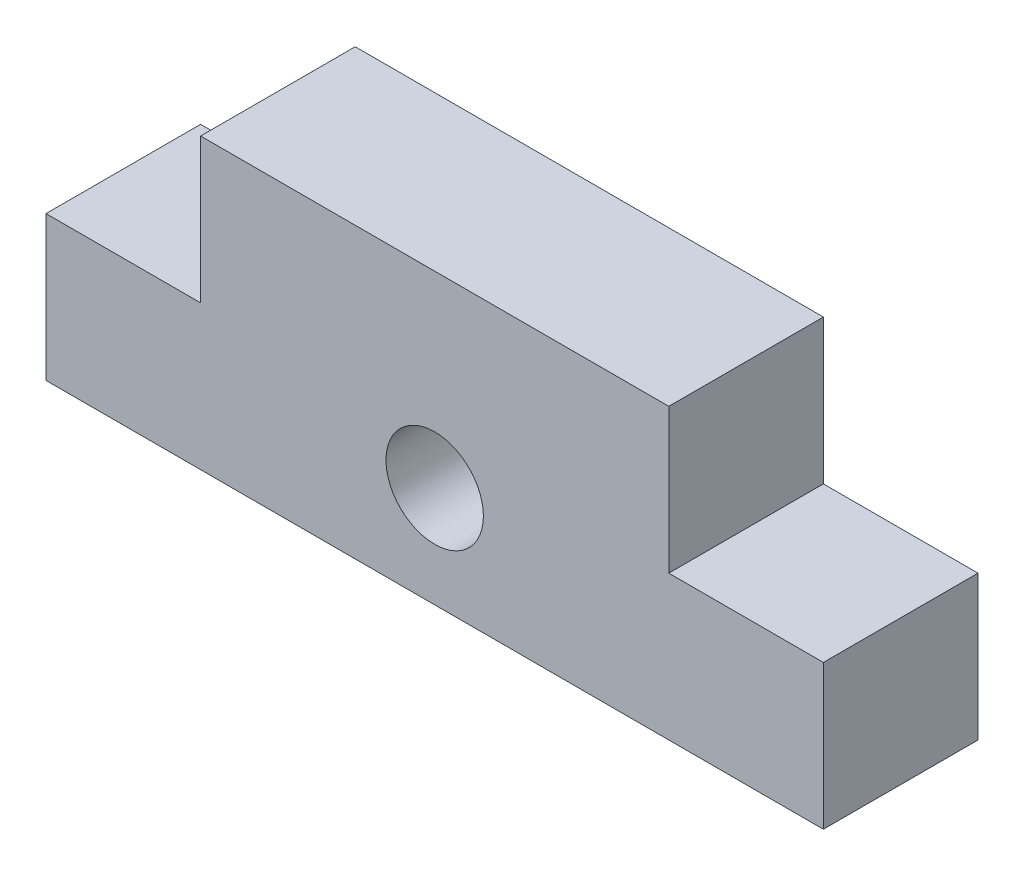
from build123d import *

# Parameters (mm, degrees)
MODEL_R             = 1.685
BOSS_EXTRUDE1_DEPTH = 5.35


with BuildPart() as part:
    # Model → Boss-Extrude1 (new body)
    with BuildSketch(Plane.XY):
        Polygon((5.350000225, 9.999999776), (5.350000225, 4.999999888), (0, 4.999999888), (0, 0), (26.90000087, 0), (26.90000087, 4.999999888), (21.550000645, 4.999999888), (21.550000645, 9.999999776), align=None)
        with Locations((13.450000435, 3.499999944)):
            Circle(MODEL_R, mode=Mode.SUBTRACT)
    extrude(amount=BOSS_EXTRUDE1_DEPTH)


solid = part.part
